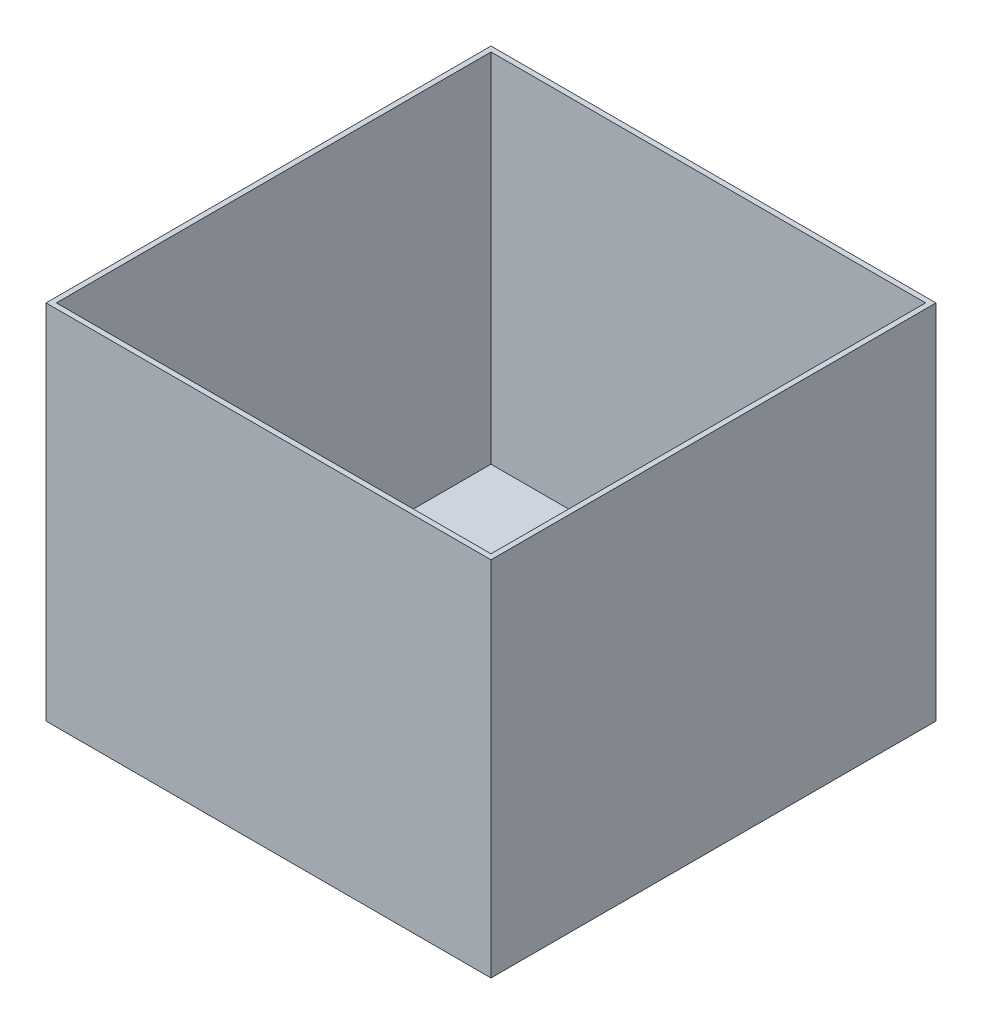
from build123d import *

# Parameters (mm, degrees)
SKETCH_1_W      = 430
SKETCH_1_H      = 430
SKETCH_1_W_2    = 420
SKETCH_1_H_2    = 420
EXTRUDE_1_DEPTH = 350
SKETCH_2_W      = 430
SKETCH_2_H      = 430
EXTRUDE_2_DEPTH = 5


with BuildPart() as part:
    # Эскиз1 → Бобышка-Вытянуть1 (new body)
    with BuildSketch(Plane(origin=(0, -55, 0), x_dir=(1, 0, 0), z_dir=(0, 1, 0))):
        Rectangle(SKETCH_1_W, SKETCH_1_H)
        Rectangle(SKETCH_1_W_2, SKETCH_1_H_2, mode=Mode.SUBTRACT)
    extrude(amount=EXTRUDE_1_DEPTH)

    # Эскиз2 → Бобышка-Вытянуть2 (add)
    with BuildSketch(Plane(origin=(0, -55, 0), x_dir=(1, 0, 0), z_dir=(0, 1, 0))):
        Rectangle(SKETCH_2_W, SKETCH_2_H)
    extrude(amount=EXTRUDE_2_DEPTH)


solid = part.part
